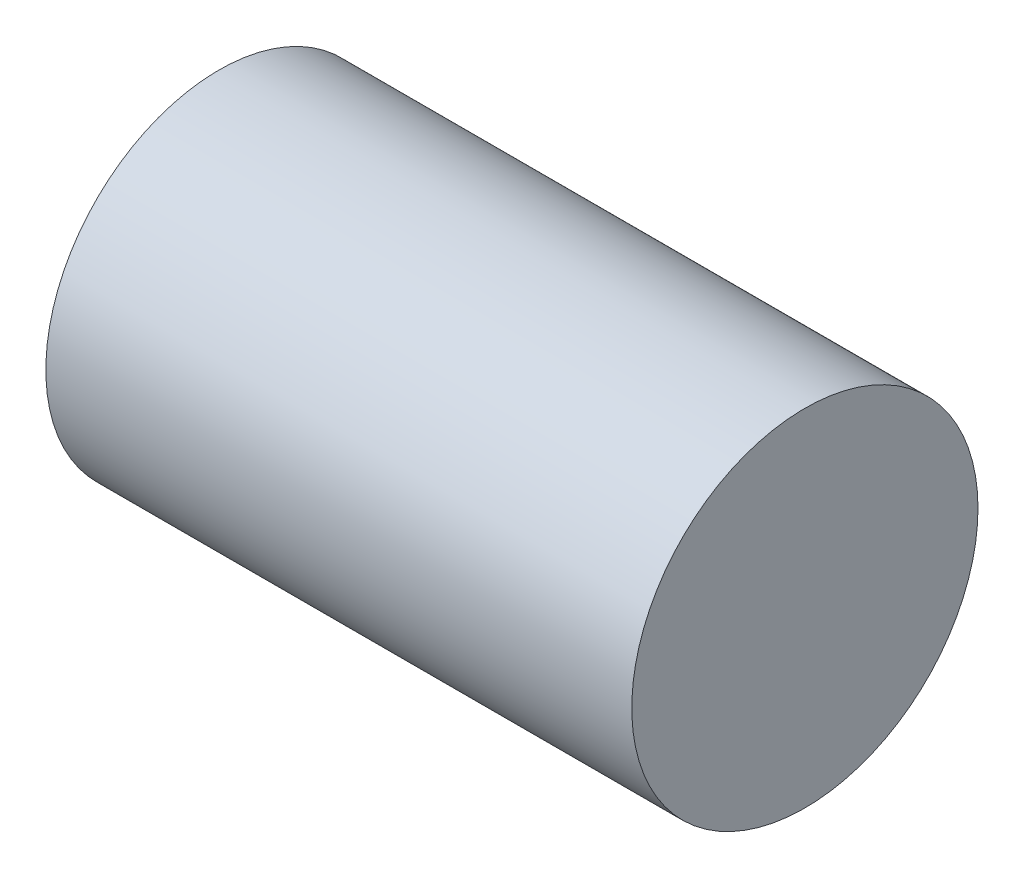
from build123d import *

# Parameters (mm, degrees)
SKETCH1_R           = 6.5
BOSS_EXTRUDE1_DEPTH = 22


with BuildPart() as part:
    # Sketch1 → Boss-Extrude1 (new body)
    with BuildSketch(Plane.YZ):
        with Locations(Location((0, 0, 0), (0, 0, 270))):
            Circle(SKETCH1_R)
    extrude(amount=BOSS_EXTRUDE1_DEPTH)


solid = part.part
